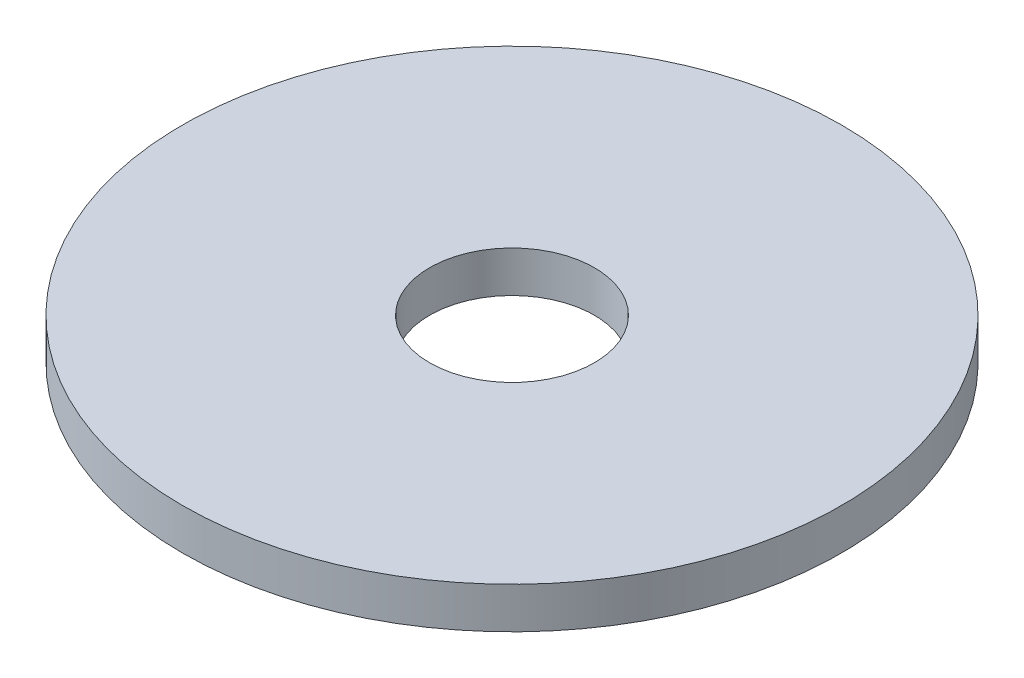
from build123d import *

# Parameters (mm, degrees)
SKETCH_1_R        = 40
SKETCH_1_R_2      = 10
EXTRUDE_271_DEPTH = 5


with BuildPart() as part:
    # 草图1 → Extrude 271 (new body)
    with BuildSketch(Plane(origin=(0, 0, 0), x_dir=(1, 0, 0), z_dir=(0, 1, 0))):
        Circle(SKETCH_1_R)
        Circle(SKETCH_1_R_2, mode=Mode.SUBTRACT)
    extrude(amount=EXTRUDE_271_DEPTH)


solid = part.part
